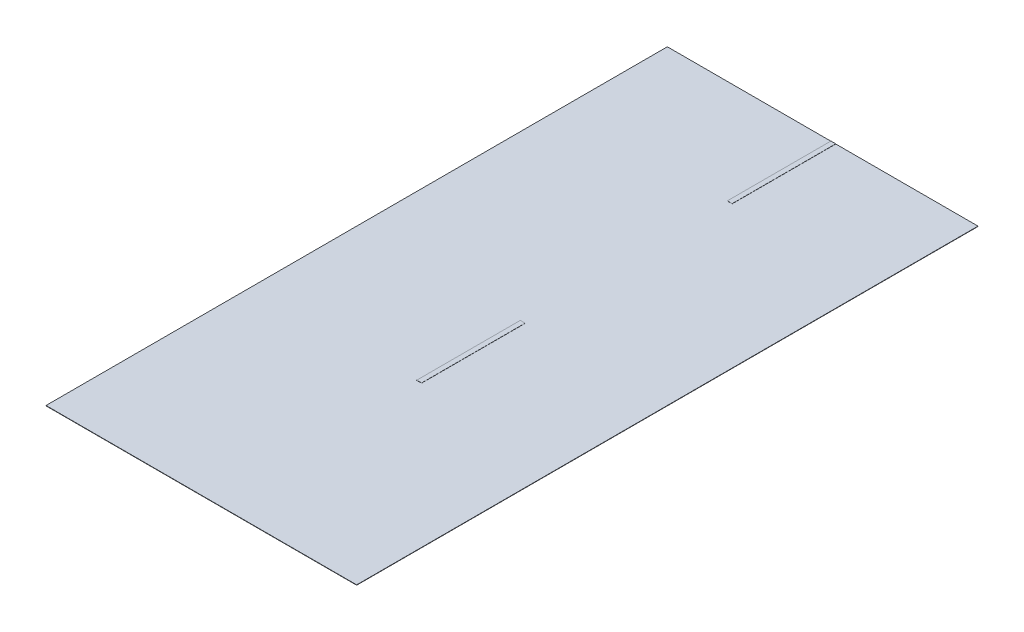
from build123d import *

# Parameters (mm, degrees)
SKETCH3_W           = 9144
SKETCH3_H           = 18288
BOSS_EXTRUDE1_DEPTH = 10
SKETCH4_W           = 142.4
SKETCH4_H           = 3048
BOSS_EXTRUDE2_DEPTH = 5


with BuildPart() as part:
    # Sketch3 → Boss-Extrude1 (new body)
    with BuildSketch(Plane(origin=(0, 0, 0), x_dir=(1, 0, 0), z_dir=(0, 1, 0))):
        with Locations((0, -9144)):
            Rectangle(SKETCH3_W, SKETCH3_H)
    extrude(amount=BOSS_EXTRUDE1_DEPTH)

    # Sketch4 → Boss-Extrude2 (add)
    with BuildSketch(Plane(origin=(0, 10, 0), x_dir=(1, 0, 0), z_dir=(0, 1, 0))):
        with Locations((314.835612115, -10668)):
            Rectangle(SKETCH4_W, SKETCH4_H)
        with Locations((314.835612115, -1524)):
            Rectangle(SKETCH4_W, SKETCH4_H)
    extrude(amount=BOSS_EXTRUDE2_DEPTH)


solid = part.part
